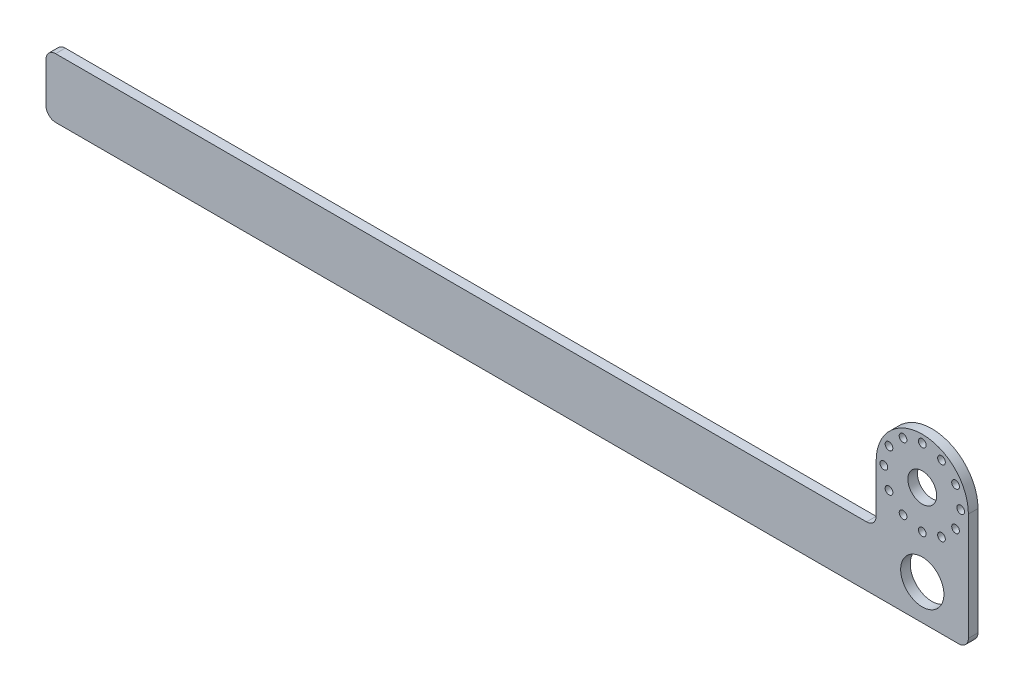
from build123d import *

# Parameters (mm, degrees)
SKETCH1_R           = 9.525
SKETCH1_R_2         = 2.54
SKETCH1_R_3         = 14.2875
BOSS_EXTRUDE1_DEPTH = 6.35
FILLET2_R           = 6.35


with BuildPart() as part:
    # Sketch1 → Boss-Extrude1 (new body)
    with BuildSketch(Plane.XY):
        with BuildLine():
            Line((0, 0), (0, 39.37))
            Line((0, 39.37), (40.53078, 39.37))
            Line((40.53078, 39.37), (548.64, 39.37))
            Line((548.64, 39.37), (548.64, 77.47))
            ThreePointArc((548.64, 77.47), (579.12, 107.95), (609.6, 77.47))
            Line((609.6, 77.47), (609.6, 0))
            Line((609.6, 0), (0, 0))
        make_face()
        with Locations((579.12, 77.47)):
            Circle(SKETCH1_R, mode=Mode.SUBTRACT)
        with Locations((579.12, 102.87)):
            Circle(SKETCH1_R_2, mode=Mode.SUBTRACT)
        with Locations((591.82, 99.467045256)):
            Circle(SKETCH1_R_2, mode=Mode.SUBTRACT)
        with Locations((601.117045256, 90.17)):
            Circle(SKETCH1_R_2, mode=Mode.SUBTRACT)
        with Locations((604.52, 77.47)):
            Circle(SKETCH1_R_2, mode=Mode.SUBTRACT)
        with Locations((601.117045256, 64.77)):
            Circle(SKETCH1_R_2, mode=Mode.SUBTRACT)
        with Locations((591.82, 55.472954744)):
            Circle(SKETCH1_R_2, mode=Mode.SUBTRACT)
        with Locations((579.12, 52.07)):
            Circle(SKETCH1_R_2, mode=Mode.SUBTRACT)
        with Locations((566.42, 55.472954744)):
            Circle(SKETCH1_R_2, mode=Mode.SUBTRACT)
        with Locations((557.122954744, 64.77)):
            Circle(SKETCH1_R_2, mode=Mode.SUBTRACT)
        with Locations((553.72, 77.47)):
            Circle(SKETCH1_R_2, mode=Mode.SUBTRACT)
        with Locations((557.122954744, 90.17)):
            Circle(SKETCH1_R_2, mode=Mode.SUBTRACT)
        with Locations((566.42, 99.467045256)):
            Circle(SKETCH1_R_2, mode=Mode.SUBTRACT)
        with Locations((579.12, 23.378627903)):
            Circle(SKETCH1_R_3, mode=Mode.SUBTRACT)
    extrude(amount=BOSS_EXTRUDE1_DEPTH)

    # Fillet2
    fillet2_edges = [part.edges().sort_by_distance(p)[0] for p in [
        (609.6, 0, 3.175),
        (0, 0, 3.175),
        (0, 39.37, 3.175),
        (548.64, 39.37, 3.175),
    ]]
    fillet(fillet2_edges, radius=FILLET2_R)


solid = part.part
